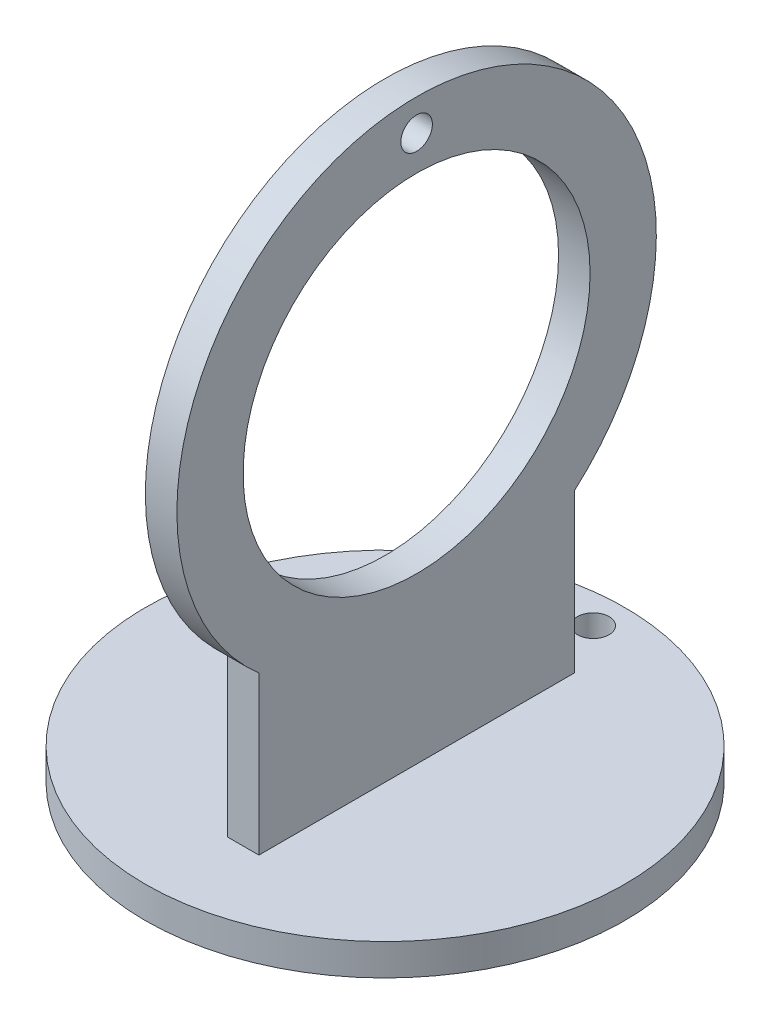
from build123d import *

# Parameters (mm, degrees)
SKETCH_1_R          = 38
SKETCH_1_R_2        = 2.5
EXTRUDE_1_DEPTH     = 5
SKETCH_5_R          = 2.5
EXTRUDE_3_DEPTH     = 5
CUT_EXTRUDE_1_REACH = 114.375
SKETCH_6_R          = 27.5


with BuildPart() as part:
    # 草图1 → 凸台-拉伸1 (new body)
    with BuildSketch(Plane(origin=(0, 0, 0), x_dir=(1, 0, 0), z_dir=(0, 1, 0))):
        with Locations(Location((0, 0, 0), (0, 0, 270))):
            Circle(SKETCH_1_R)
        with Locations(Location((0, 33, 0), (0, 0, 270))):
            Circle(SKETCH_1_R_2, mode=Mode.SUBTRACT)
    extrude(amount=EXTRUDE_1_DEPTH)

    # 草图5 → 凸台-拉伸3 (add)
    with BuildSketch(Plane(origin=(0, 0, 0), x_dir=(0, 0, -1), z_dir=(1, 0, 0))):
        with BuildLine():
            Line((-25, 30), (-25, 5))
            Line((-25, 5), (25, 5))
            Line((25, 5), (25, 30))
            ThreePointArc((25, 30), (0, 96.618176043), (-25, 30))
        make_face()
        with Locations((0, 91.618176043)):
            Circle(SKETCH_5_R, mode=Mode.SUBTRACT)
    extrude(amount=EXTRUDE_3_DEPTH)

    # 草图6 → 切除-拉伸1 (cut, up to next)
    with BuildSketch(Plane(origin=(5, 0, 0), x_dir=(0, 0, -1), z_dir=(1, 0, 0)), mode=Mode.PRIVATE) as cut_extrude_1_sk1:
        with Locations((0, 58.618176043)):
            Circle(SKETCH_6_R)
    cut_extrude_1_tool1 = extrude(cut_extrude_1_sk1.sketch, amount=-CUT_EXTRUDE_1_REACH, mode=Mode.PRIVATE) & part.part
    add(cut_extrude_1_tool1.solids().sort_by_distance((5, 58.618176, 0))[0], mode=Mode.SUBTRACT)


solid = part.part
